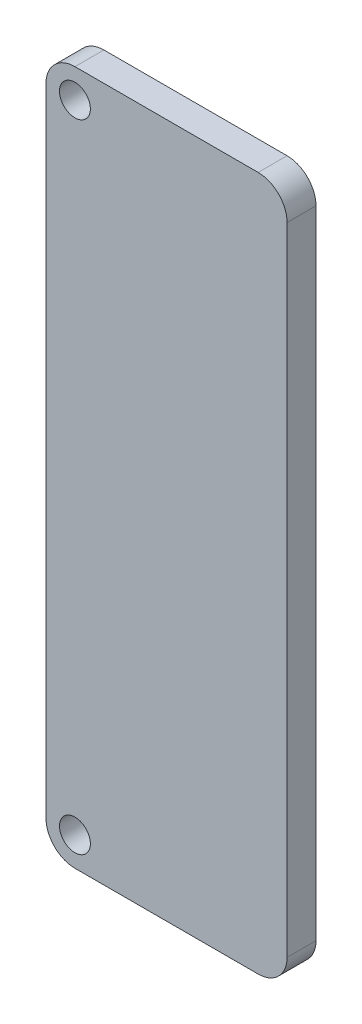
from build123d import *

# Parameters (mm, degrees)
SKETCH1_R           = 1.6
BOSS_EXTRUDE1_DEPTH = 3
CUT_EXTRUDE1_DEPTH  = 2
SKETCH3_W           = 5
SKETCH3_H           = 8.5
CUT_EXTRUDE2_DEPTH  = 2.7
SKETCH4_W           = 4
SKETCH4_H           = 3
BOSS_EXTRUDE2_DEPTH = 2
FILLET1_R           = 3


with BuildPart() as part:
    # Sketch1 → Boss-Extrude1 (new body)
    with BuildSketch(Plane.XY):
        with BuildLine():
            Line((0, 36), (0, -36))
            Line((0, -36), (-22, -36))
            ThreePointArc((-22, -36), (-24.121320344, -35.121320344), (-25, -33))
            Line((-25, -33), (-25, 33))
            ThreePointArc((-25, 33), (-24.121320344, 35.121320344), (-22, 36))
            Line((-22, 36), (0, 36))
        make_face()
        with Locations((-22, 33)):
            Circle(SKETCH1_R, mode=Mode.SUBTRACT)
        with Locations((-22, -33)):
            Circle(SKETCH1_R, mode=Mode.SUBTRACT)
    extrude(amount=BOSS_EXTRUDE1_DEPTH)

    # Sketch2 → Cut-Extrude1 (cut)
    with BuildSketch(Plane(origin=(0, 0, 0), x_dir=(-1, 0, 0), z_dir=(0, 0, -1))):
        Polygon((24.4, 30), (12, 30), (12, -3), (3, -3), (3, -30.5), (24.4, -30.5), align=None)
    extrude(amount=-CUT_EXTRUDE1_DEPTH, mode=Mode.SUBTRACT)

    # Sketch3 → Cut-Extrude2 (cut)
    with BuildSketch(Plane(origin=(0, 0, 0), x_dir=(-1, 0, 0), z_dir=(0, 0, -1))):
        with Locations((22.5, 0)):
            Rectangle(SKETCH3_W, SKETCH3_H)
    extrude(amount=-CUT_EXTRUDE2_DEPTH, mode=Mode.SUBTRACT)

    # Sketch4 → Boss-Extrude2 (add)
    with BuildSketch(Plane(origin=(0, 0, 0), x_dir=(-1, 0, 0), z_dir=(0, 0, -1))):
        with Locations((23, 5.75)):
            Rectangle(SKETCH4_W, SKETCH4_H)
    extrude(amount=-BOSS_EXTRUDE2_DEPTH)

    # Fillet1
    fillet1_edges = [part.edges().sort_by_distance(p)[0] for p in [
        (0, 36, 1.5),
        (0, -36, 1.5),
    ]]
    fillet(fillet1_edges, radius=FILLET1_R)


solid = part.part
